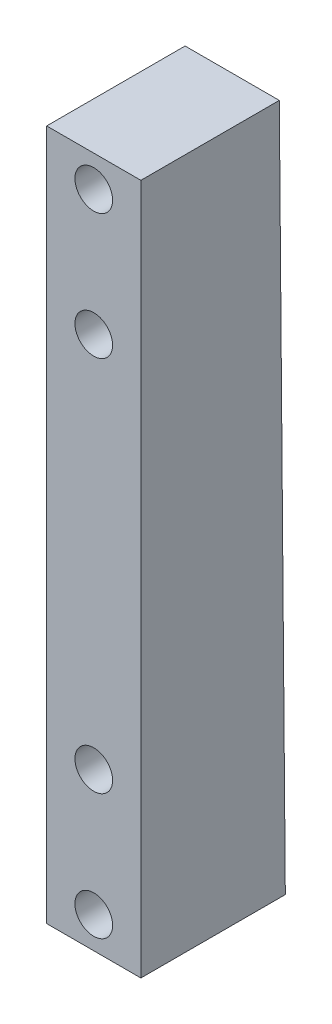
from build123d import *

# Parameters (mm, degrees)
SKETCH1_W                                      = 110
SKETCH1_H                                      = 23
BOSS_EXTRUDE1_DEPTH                            = 15
F_6_0_6_DIAMETER_HOLE1_D                       = 6
F_6_0_6_DIAMETER_HOLE1_DEPTH                   = 6.01
F_6_0_6_DIAMETER_HOLE1_TIP                     = 1.802581857
CSK_FOR_M3_5_FLAT_HEAD_MACHINE_SCREW1_AT_COUNT = 2
CSK_FOR_M3_5_FLAT_HEAD_MACHINE_SCREW1_AT_PITCH = 100
CUT_EXTRUDE1_DEPTH                             = 62.473571557


with BuildPart() as part:
    # Sketch1 → Boss-Extrude1 (new body)
    with BuildSketch(Plane(origin=(-7.5, 0, 0), x_dir=(0, -1, 0), z_dir=(-1, 0, 0))):
        with Locations((0, -11.5)):
            Rectangle(SKETCH1_W, SKETCH1_H)
    extrude(amount=-BOSS_EXTRUDE1_DEPTH)

    # Ø6.0 (6) Diameter Hole1
    with Locations(Plane.XY):
        with Locations((0, 30), (0, -30)):
            Hole(F_6_0_6_DIAMETER_HOLE1_D / 2, depth=F_6_0_6_DIAMETER_HOLE1_DEPTH)
            with Locations((0, 0, -(F_6_0_6_DIAMETER_HOLE1_DEPTH + F_6_0_6_DIAMETER_HOLE1_TIP / 2))):  # 118° drill point
                Cone(0, F_6_0_6_DIAMETER_HOLE1_D / 2, F_6_0_6_DIAMETER_HOLE1_TIP, mode=Mode.SUBTRACT)

    # Sketch4 → CSK for M3.5 Flat Head Machine Screw1 (revolve, cut)
    with BuildSketch(Plane(origin=(0, 50, 0), x_dir=(0, -1, 0), z_dir=(1, 0, 0))):
        Polygon((0, 0), (0, 23), (2.1, 23), (2.1, 6.540774559), (3, 6), (3, 0), align=None)
    csk_for_m3_5_flat_head_machine_screw1 = revolve(axis=Axis((0, 50, 6.35), (0, 0, -1)), mode=Mode.SUBTRACT)

    # CSK for M3.5 Flat Head Machine Screw1 at: CSK for M3.5 Flat Head Machine Screw1 ×2
    with Locations(*[(0, -i * CSK_FOR_M3_5_FLAT_HEAD_MACHINE_SCREW1_AT_PITCH, 0) for i in range(1, CSK_FOR_M3_5_FLAT_HEAD_MACHINE_SCREW1_AT_COUNT)]):
        add(csk_for_m3_5_flat_head_machine_screw1, mode=Mode.SUBTRACT)

    # Sketch6 → Cut-Extrude1 (cut, through all)
    with BuildSketch(Plane(origin=(7.5, 0, 0), x_dir=(0, 0, -1), z_dir=(1, 0, 0))):
        Polygon((23, -55), (22.040044543, 55), (23, 55), align=None)
    extrude(amount=-CUT_EXTRUDE1_DEPTH, mode=Mode.SUBTRACT)


solid = part.part
